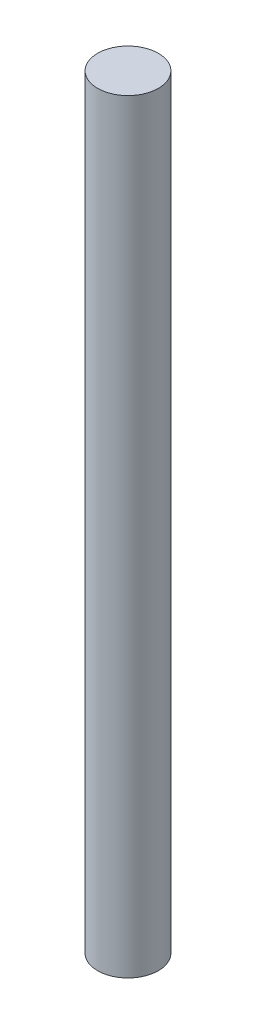
from build123d import *

# Parameters (mm, degrees)
SKETCH_1_R      = 2.5
EXTRUDE_1_DEPTH = 62.9


with BuildPart() as part:
    # 草图1 → 凸台-拉伸1 (new body)
    with BuildSketch(Plane(origin=(0, 0, 0), x_dir=(1, 0, 0), z_dir=(0, 1, 0))):
        with Locations(Location((0, -0.456480485, 0), (0, 0, 270))):
            Circle(SKETCH_1_R)
    extrude(amount=EXTRUDE_1_DEPTH)


solid = part.part
